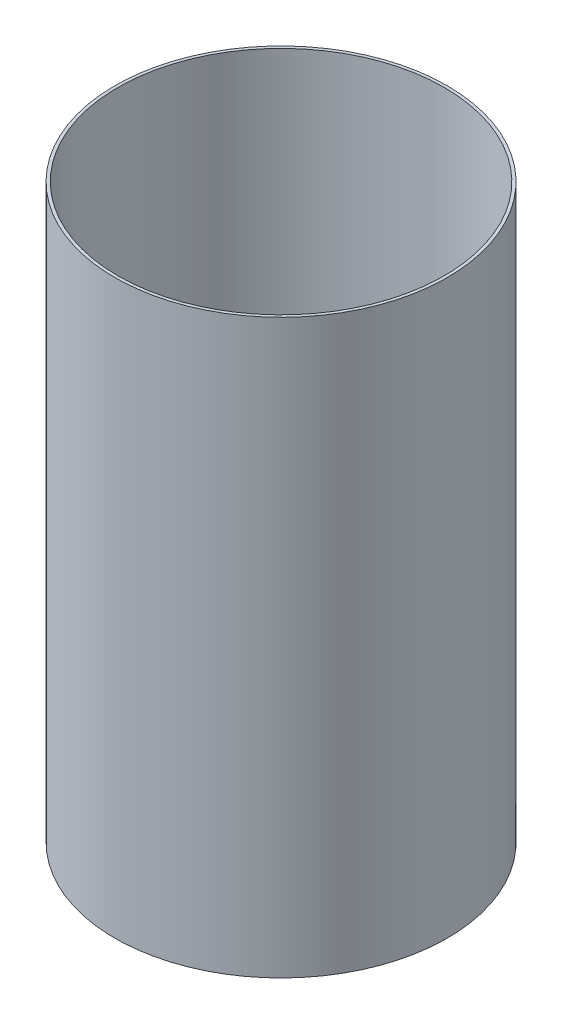
from build123d import *

# Parameters (mm, degrees)
SKETCH1_R           = 88.519
SKETCH1_R_2         = 86.9315
BOSS_EXTRUDE1_DEPTH = 304.8


with BuildPart() as part:
    # Sketch1 → Boss-Extrude1 (new body)
    with BuildSketch(Plane(origin=(0, 0, 0), x_dir=(1, 0, 0), z_dir=(0, 1, 0))):
        with Locations(Location((0, 0, 0), (0, 0, 90))):
            Circle(SKETCH1_R)
        with Locations(Location((0, 0, 0), (0, 0, 90))):
            Circle(SKETCH1_R_2, mode=Mode.SUBTRACT)
    extrude(amount=BOSS_EXTRUDE1_DEPTH)


solid = part.part
